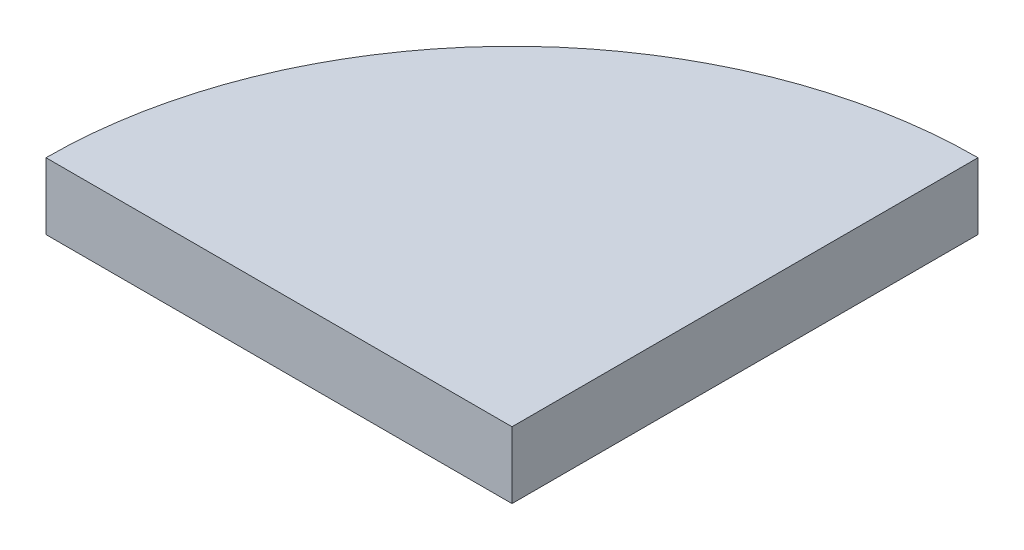
from build123d import *

# Parameters (mm, degrees)
BOSS_EXTRUDE1_DEPTH = 10


with BuildPart() as part:
    # Sketch1 → Boss-Extrude1 (new body)
    with BuildSketch(Plane(origin=(0, 0, 0), x_dir=(1, 0, 0), z_dir=(0, 1, 0))):
        with BuildLine():
            Line((-70, 0), (0, 0))
            Line((0, 0), (0, 70))
            ThreePointArc((0, 70), (-49.497474683, 49.497474683), (-70, 0))
        make_face()
    extrude(amount=BOSS_EXTRUDE1_DEPTH)


solid = part.part
